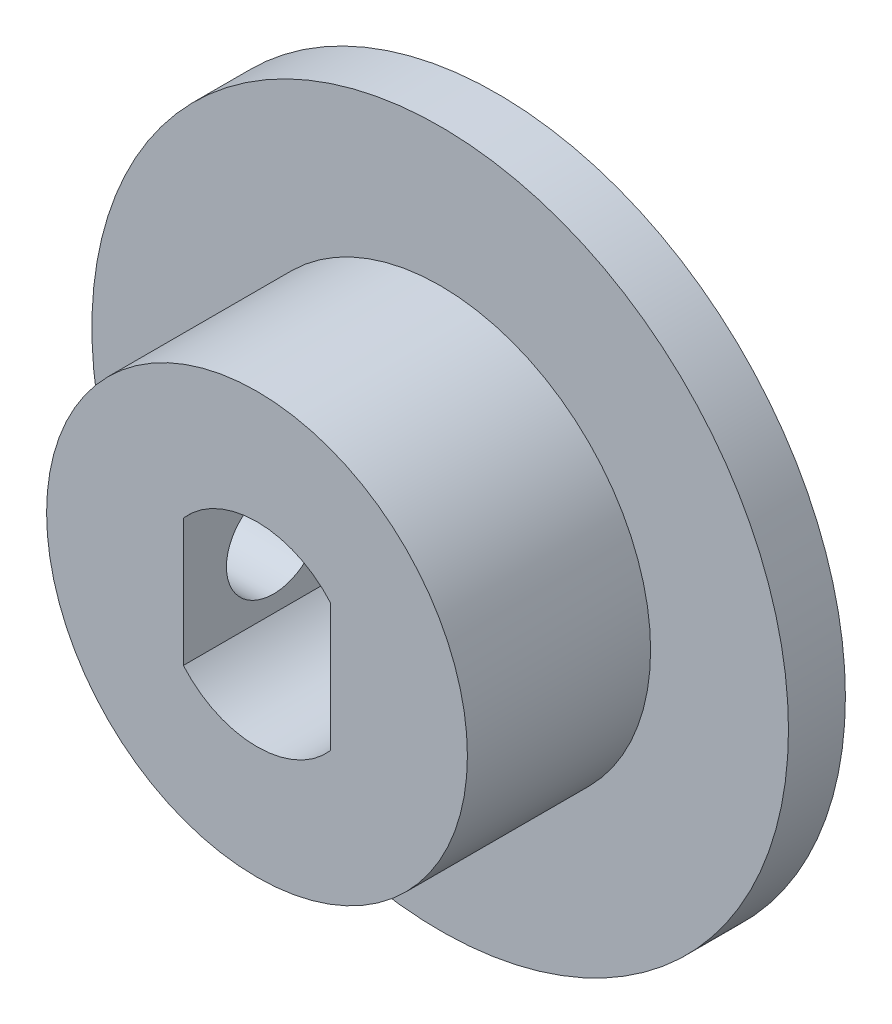
from build123d import *

# Parameters (mm, degrees)
SKETCH1_R           = 17.8689
BOSS_EXTRUDE1_DEPTH = 2.921
SKETCH2_R           = 10.795
BOSS_EXTRUDE2_DEPTH = 9.398
CUT_EXTRUDE1_DEPTH  = 29.113216383
SKETCH4_R           = 2.413
CUT_EXTRUDE2_DEPTH  = 16.002


with BuildPart() as part:
    # Sketch1 → Boss-Extrude1 (new body)
    with BuildSketch(Plane.XY):
        Circle(SKETCH1_R)
    extrude(amount=BOSS_EXTRUDE1_DEPTH)

    # Sketch2 → Boss-Extrude2 (add)
    with BuildSketch(Plane.XY.offset(2.921)):
        Circle(SKETCH2_R)
    extrude(amount=BOSS_EXTRUDE2_DEPTH)

    # Sketch3 → Cut-Extrude1 (cut, through all)
    with BuildSketch(Plane.XY.offset(12.319)):
        with BuildLine():
            Line((-3.77825, -3.274862888), (-3.77825, 3.274862888))
            ThreePointArc((-3.77825, 3.274862888), (0, 4.99999), (3.77825, 3.274862888))
            Line((3.77825, 3.274862888), (3.77825, -3.274862888))
            ThreePointArc((3.77825, -3.274862888), (0, -4.99999), (-3.77825, -3.274862888))
        make_face()
    extrude(amount=-CUT_EXTRUDE1_DEPTH, mode=Mode.SUBTRACT)

    # Sketch4 → Cut-Extrude2 (cut)
    with BuildSketch(Plane(origin=(0, 0, 0), x_dir=(0, 0, -1), z_dir=(1, 0, 0))):
        with Locations(Location((-7.6962, 0, 0), (0, 0, 180))):
            Circle(SKETCH4_R)
    extrude(amount=-CUT_EXTRUDE2_DEPTH, mode=Mode.SUBTRACT)


solid = part.part
